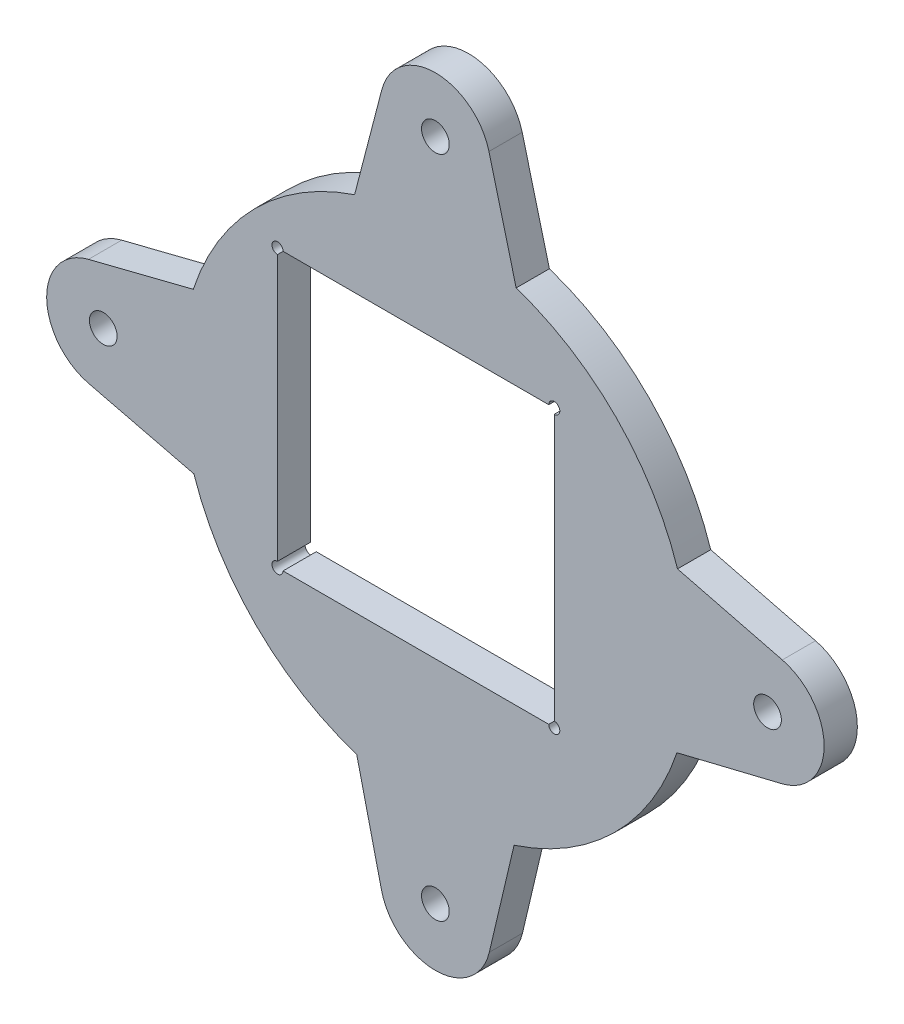
from build123d import *

# Parameters (mm, degrees)
SKETCH1_R           = 1.25
SKETCH1_W           = 25
SKETCH1_H           = 25
BOSS_EXTRUDE1_DEPTH = 3
SKETCH2_R           = 0.5
CUT_EXTRUDE1_DEPTH  = 10


with BuildPart() as part:
    # Sketch1 → Boss-Extrude1 (new body)
    with BuildSketch(Plane.XY):
        with BuildLine():
            Line((-33.186840593, 0.47786898), (-23.721123859, 2.863592672))
            ThreePointArc((-23.721123859, 2.863592672), (-18.180104911, 11.940895034), (-9.147920803, 17.555158954))
            Line((-9.147920803, 17.555158954), (-6.689897995, 27.002359316))
            ThreePointArc((-6.689897995, 27.002359316), (-1.851003919, 30.743350134), (2.987890157, 27.002359316))
            Line((2.987890157, 27.002359316), (5.445912965, 17.555158954))
            ThreePointArc((5.445912965, 17.555158954), (14.478097073, 11.940895034), (20.019116021, 2.863592672))
            Line((20.019116021, 2.863592672), (29.484832754, 0.47786898))
            ThreePointArc((29.484832754, 0.47786898), (33.262819731, -4.389413936), (29.448135263, -9.227989241))
            Line((29.448135263, -9.227989241), (19.964648755, -11.542066696))
            ThreePointArc((19.964648755, -11.542066696), (14.345988249, -20.586299119), (5.256227018, -26.131001706))
            Line((5.256227018, -26.131001706), (3.015488633, -35.632083871))
            ThreePointArc((3.015488633, -35.632083871), (-1.851003919, -39.484368645), (-6.717496471, -35.632083871))
            Line((-6.717496471, -35.632083871), (-8.958234856, -26.131001706))
            ThreePointArc((-8.958234856, -26.131001706), (-18.047996087, -20.586299119), (-23.666656594, -11.542066696))
            Line((-23.666656594, -11.542066696), (-33.150143101, -9.227989241))
            ThreePointArc((-33.150143101, -9.227989241), (-36.96482757, -4.389413936), (-33.186840593, 0.47786898))
        make_face()
        with Locations((-1.851003919, 25.743350134)):
            Circle(SKETCH1_R, mode=Mode.SUBTRACT)
        with Locations((28.148996081, -4.256649866)):
            Circle(SKETCH1_R, mode=Mode.SUBTRACT)
        with Locations((-1.851003919, -34.256649866)):
            Circle(SKETCH1_R, mode=Mode.SUBTRACT)
        with Locations((-31.851003919, -4.256649866)):
            Circle(SKETCH1_R, mode=Mode.SUBTRACT)
        with Locations((-3.613074624, -2.60843855)):
            Rectangle(SKETCH1_W, SKETCH1_H, mode=Mode.SUBTRACT)
    extrude(amount=BOSS_EXTRUDE1_DEPTH)

    # Sketch2 → Cut-Extrude1 (cut)
    with BuildSketch(Plane.XY.offset(3)):
        with Locations((-16.113074624, 9.89156145)):
            Circle(SKETCH2_R)
        with Locations((8.886925376, 9.89156145)):
            Circle(SKETCH2_R)
        with Locations((8.886925376, -15.10843855)):
            Circle(SKETCH2_R)
        with Locations((-16.113074624, -15.10843855)):
            Circle(SKETCH2_R)
    extrude(amount=-CUT_EXTRUDE1_DEPTH, mode=Mode.SUBTRACT)


solid = part.part
